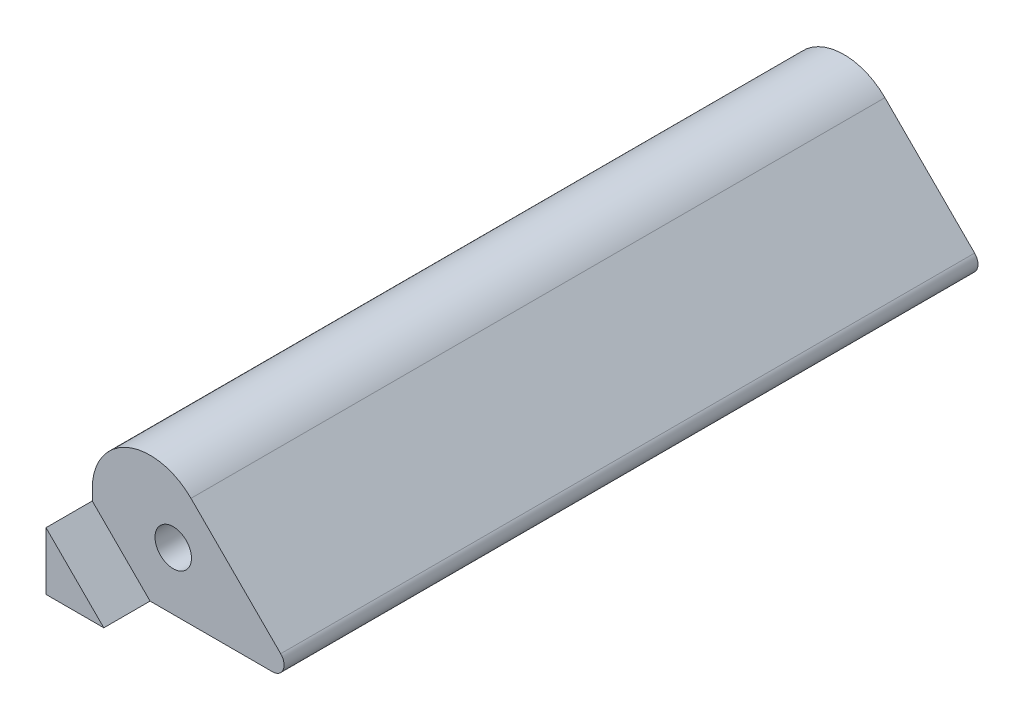
from build123d import *

# Parameters (mm, degrees)
RESSALTO_EXTRUS_O1_DEPTH                    = 60
RESSALTO_EXTRUS_O2_DEPTH                    = 4
RESSALTO_EXTRUS_O3_DEPTH                    = 4
FURO_ROSCADO_PARA_CONDU_TE_DE_M3X0_51_D     = 3.15
FURO_ROSCADO_PARA_CONDU_TE_DE_M3X0_51_DEPTH = 10
FURO_ROSCADO_PARA_CONDU_TE_DE_M3X0_51_TIP   = 0.946355475
FURO_ROSCADO_PARA_CONDU_TE_DE_M3X0_52_D     = 3.15
FURO_ROSCADO_PARA_CONDU_TE_DE_M3X0_52_DEPTH = 7.5
FURO_ROSCADO_PARA_CONDU_TE_DE_M3X0_52_TIP   = 0.946355475
FILETE1_R                                   = 1
FILETE2_R                                   = 5


with BuildPart() as part:
    # Esboço1 → Ressalto-extrusão1 (new body)
    with BuildSketch(Plane.XY):
        Polygon((0, 0), (18, 0), (0, 18), align=None)
    extrude(amount=RESSALTO_EXTRUS_O1_DEPTH)

    # Esboço2 → Ressalto-extrusão2 (add)
    with BuildSketch(Plane.XY.offset(60)):
        Polygon((0, 0), (0, 5), (5, 0), align=None)
    extrude(amount=RESSALTO_EXTRUS_O2_DEPTH)

    # Esboço3 → Ressalto-extrusão3 (add)
    with BuildSketch(Plane(origin=(0, 0, 0), x_dir=(-1, 0, 0), z_dir=(0, 0, -1))):
        Polygon((0, 0), (0, 5), (-5, 0), align=None)
    extrude(amount=RESSALTO_EXTRUS_O3_DEPTH)

    # Furo roscado para conduíte de M3x0.51
    with Locations(Plane.XY.offset(60)):
        with Locations((7, 5)):
            Hole(FURO_ROSCADO_PARA_CONDU_TE_DE_M3X0_51_D / 2, depth=FURO_ROSCADO_PARA_CONDU_TE_DE_M3X0_51_DEPTH)
            with Locations((0, 0, -(FURO_ROSCADO_PARA_CONDU_TE_DE_M3X0_51_DEPTH + FURO_ROSCADO_PARA_CONDU_TE_DE_M3X0_51_TIP / 2))):  # 118° drill point
                Cone(0, FURO_ROSCADO_PARA_CONDU_TE_DE_M3X0_51_D / 2, FURO_ROSCADO_PARA_CONDU_TE_DE_M3X0_51_TIP, mode=Mode.SUBTRACT)

    # Furo roscado para conduíte de M3x0.52
    with Locations(Plane(origin=(0, 0, 0), x_dir=(-1, 0, 0), z_dir=(0, 0, -1))):
        with Locations((-7, 5)):
            Hole(FURO_ROSCADO_PARA_CONDU_TE_DE_M3X0_52_D / 2, depth=FURO_ROSCADO_PARA_CONDU_TE_DE_M3X0_52_DEPTH)
            with Locations((0, 0, -(FURO_ROSCADO_PARA_CONDU_TE_DE_M3X0_52_DEPTH + FURO_ROSCADO_PARA_CONDU_TE_DE_M3X0_52_TIP / 2))):  # 118° drill point
                Cone(0, FURO_ROSCADO_PARA_CONDU_TE_DE_M3X0_52_D / 2, FURO_ROSCADO_PARA_CONDU_TE_DE_M3X0_52_TIP, mode=Mode.SUBTRACT)

    # Filete1
    filete1_edges = [part.edges().sort_by_distance(p)[0] for p in [
        (18, 0, 30),
    ]]
    fillet(filete1_edges, radius=FILETE1_R)

    # Filete2
    filete2_edges = [part.edges().sort_by_distance(p)[0] for p in [
        (0, 18, 30),
    ]]
    fillet(filete2_edges, radius=FILETE2_R)


solid = part.part
